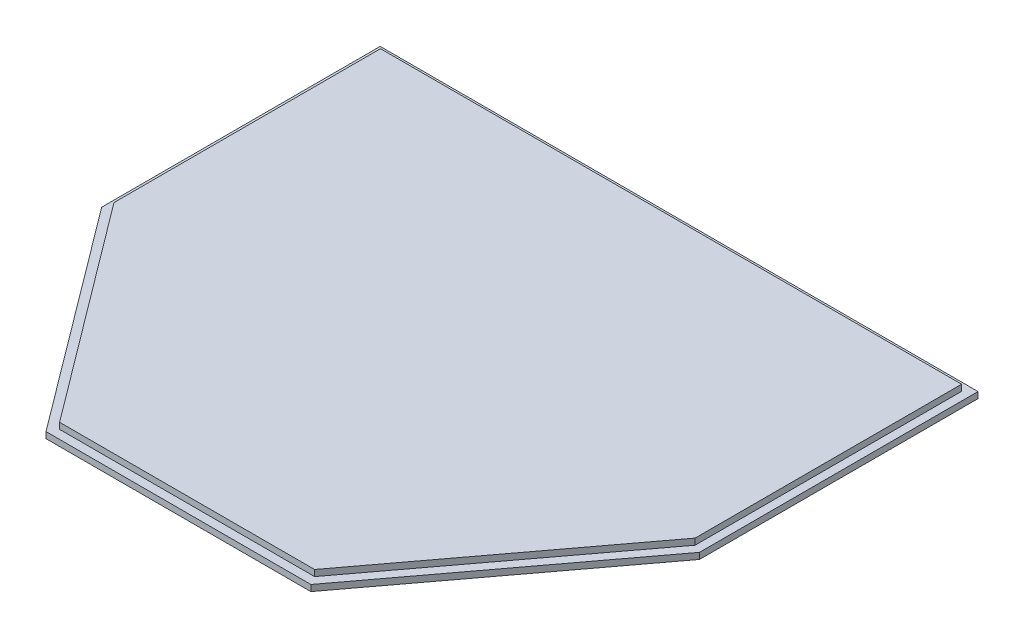
from build123d import *

# Parameters (mm, degrees)
EXTRUDE_1_DEPTH = 5
EXTRUDE_2_DEPTH = 5


with BuildPart() as part:
    # 草图1 → 凸台-拉伸1 (new body)
    with BuildSketch(Plane(origin=(0, 0, 0), x_dir=(1, 0, 0), z_dir=(0, 1, 0))):
        Polygon((-241.5, 0), (241.5, 0), (241.5, -225), (107, -404.5), (-107, -404.5), (-241.5, -225), align=None)
    extrude(amount=EXTRUDE_1_DEPTH)

    # 草图2 → 凸台-拉伸2 (add)
    with BuildSketch(Plane(origin=(0, 5, 0), x_dir=(1, 0, 0), z_dir=(0, 1, 0))):
        Polygon((-234.75, -6.5), (234.75, -6.5), (234.75, -221.833333333), (103, -397.5), (-103, -397.5), (-234.75, -221.833333333), align=None)
    extrude(amount=EXTRUDE_2_DEPTH)


solid = part.part
